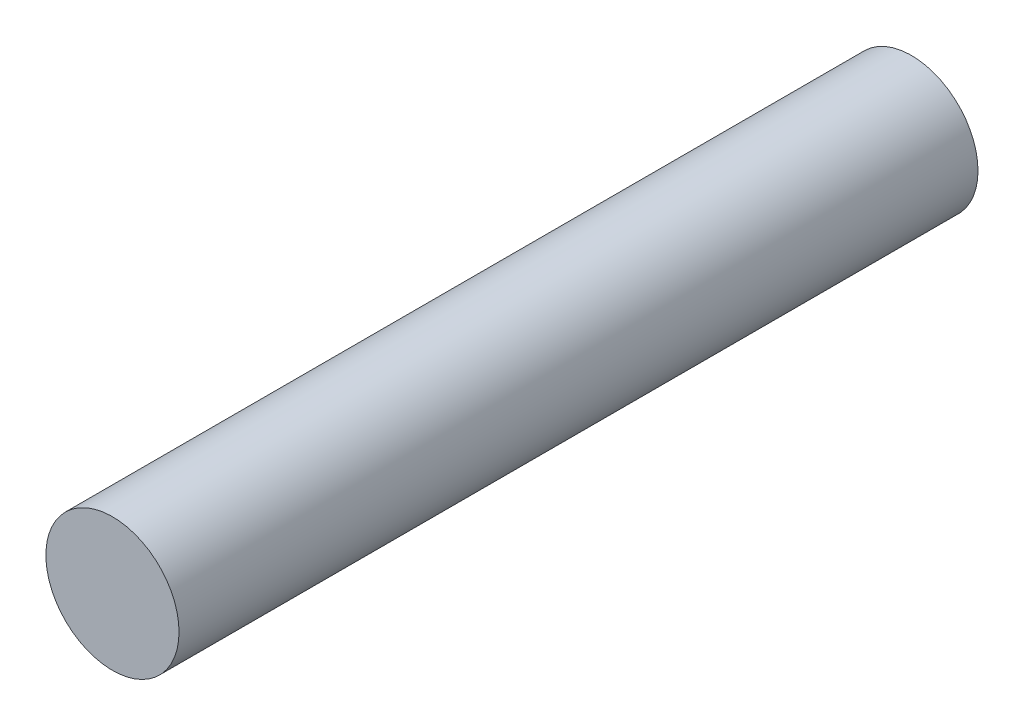
from build123d import *

# Parameters (mm, degrees)
SKETCH2_R           = 38.1
BOSS_EXTRUDE1_DEPTH = 457.2


with BuildPart() as part:
    # Sketch2 → Boss-Extrude1 (new body)
    with BuildSketch(Plane.XY):
        Circle(SKETCH2_R)
    extrude(amount=BOSS_EXTRUDE1_DEPTH)


solid = part.part
